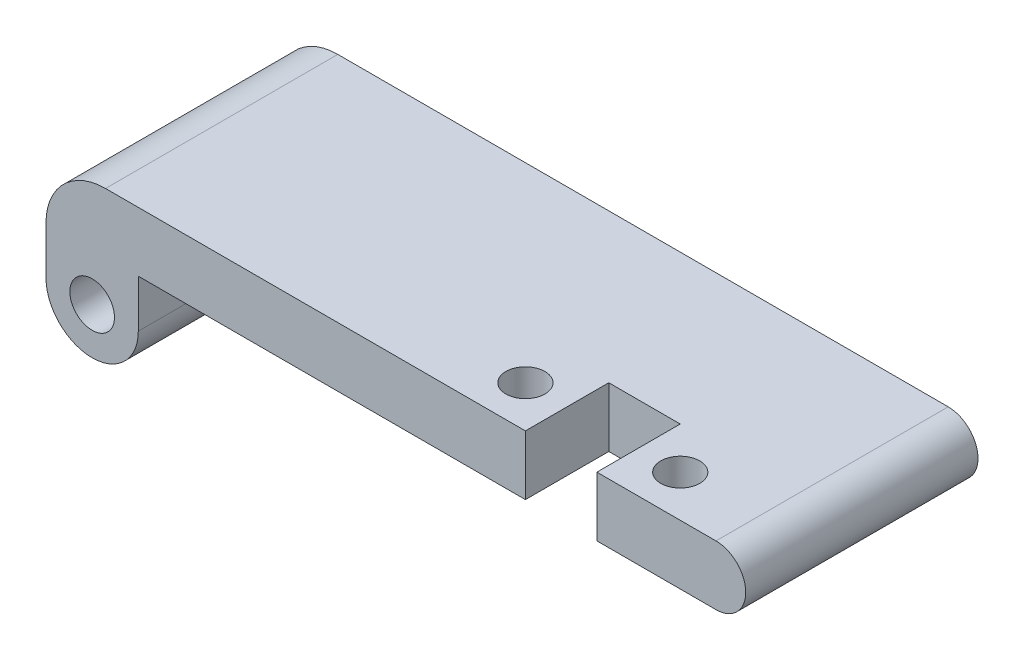
from build123d import *

# Parameters (mm, degrees)
SKETCH1_R                = 2.38125
BOSS_EXTRUDE1_DEPTH      = 38.1
FILLET1_R                = 6.35
SKETCH3_W                = 38.1
SKETCH3_H                = 6.35
BOSS_EXTRUDE2_DEPTH      = 12.7
SKETCH2_W                = 7.62
SKETCH2_H                = 8.89
CUT_EXTRUDE7_DEPTH       = 66.019560197
BOSS_EXTRUDE5_DEPTH      = 22.225
BOSS_EXTRUDE5_DEPTH_BACK = 9.525
SKETCH10_W               = 7.62
SKETCH10_H               = 8.89
CUT_EXTRUDE1_DEPTH       = 62.376176621
CUT_EXTRUDE1_DEPTH_BACK  = 62.376176621
SKETCH5_R                = 1.905
SKETCH6_W                = 8.89
SKETCH6_H                = 8.89
BOSS_EXTRUDE4_DEPTH      = 3.175
CUT_EXTRUDE2_DEPTH       = 71.485759779
CUT_EXTRUDE2_DEPTH_BACK  = 71.485759779
SKETCH7_R                = 2.0828
CUT_EXTRUDE8_DEPTH       = 13.335
SKETCH11_W               = 7.62
SKETCH11_H               = 8.89
CUT_EXTRUDE9_DEPTH       = 68.896996404
SKETCH12_W               = 8.89
SKETCH12_H               = 8.89
CUT_EXTRUDE10_DEPTH      = 3.175
CUT_EXTRUDE11_DEPTH      = 58.406346519


with BuildPart() as part:
    # Sketch1 → Boss-Extrude1 (new body)
    with BuildSketch(Plane.XY):
        with BuildLine():
            Line((-37.385625, -8.255), (-37.385625, -3.175))
            Line((-37.385625, -3.175), (-37.385625, 3.175))
            Line((-37.385625, 3.175), (37.385625, 3.175))
            Line((37.385625, 3.175), (37.385625, -3.175))
            Line((37.385625, -3.175), (-27.543125, -3.175))
            Line((-27.543125, -3.175), (-27.543125, -8.255))
            ThreePointArc((-27.543125, -8.255), (-32.464375, -13.17625), (-37.385625, -8.255))
        make_face()
        with Locations(Location((-32.464375, -8.255, 0), (0, 0, 180))):
            Circle(SKETCH1_R, mode=Mode.SUBTRACT)
    extrude(amount=BOSS_EXTRUDE1_DEPTH)

    # Fillet1
    fillet1_edges = [part.edges().sort_by_distance(p)[0] for p in [
        (-37.385625, 3.175, 19.05),
    ]]
    fillet(fillet1_edges, radius=FILLET1_R)

    # Sketch3 → Boss-Extrude2 (add)
    with BuildSketch(Plane(origin=(37.385625, 0, 0), x_dir=(0, 0, -1), z_dir=(1, 0, 0))):
        with Locations((-19.05, 0)):
            Rectangle(SKETCH3_W, SKETCH3_H)
    extrude(amount=BOSS_EXTRUDE2_DEPTH)

    # Sketch2 → Cut-Extrude7 (cut, through all)
    with BuildSketch(Plane(origin=(0, 3.175, 0), x_dir=(1, 0, 0), z_dir=(0, 1, 0))):
        with Locations((17.541875, -20.32)):
            Rectangle(SKETCH2_W, SKETCH2_H)
    extrude(amount=-CUT_EXTRUDE7_DEPTH, mode=Mode.SUBTRACT)

    # Sketch10 → Boss-Extrude5 (add, two sides: drawn at the far end of the back side and taken through both)
    with BuildSketch(Plane(origin=(0, 3.175, 0), x_dir=(1, 0, 0), z_dir=(0, 1, 0)).offset(-BOSS_EXTRUDE5_DEPTH_BACK)):
        with Locations((17.541875, -20.32)):
            Rectangle(SKETCH10_W, SKETCH10_H)
    extrude(amount=BOSS_EXTRUDE5_DEPTH + BOSS_EXTRUDE5_DEPTH_BACK)

    # Sketch5 → Cut-Extrude1 (cut, two sides: drawn at the far end of the back side and taken through both)
    with BuildSketch(Plane.XY.offset(24.765).offset(-CUT_EXTRUDE1_DEPTH_BACK)):
        with Locations((17.541875, 5.715)):
            Circle(SKETCH5_R)
        with Locations((17.541875, 23.1775)):
            Circle(SKETCH5_R)
    extrude(amount=CUT_EXTRUDE1_DEPTH + CUT_EXTRUDE1_DEPTH_BACK, mode=Mode.SUBTRACT)

    # Sketch6 → Boss-Extrude4 (add)
    with BuildSketch(Plane(origin=(0, -3.175, 0), x_dir=(1, 0, 0), z_dir=(0, 1, 0))):
        with Locations((9.286875, -20.32)):
            Rectangle(SKETCH6_W, SKETCH6_H)
        with Locations((25.796875, -20.32)):
            Rectangle(SKETCH6_W, SKETCH6_H)
    extrude(amount=-BOSS_EXTRUDE4_DEPTH)

    # Sketch7 → Cut-Extrude2 (cut, two sides: drawn at the far end of the back side and taken through both)
    with BuildSketch(Plane(origin=(0, -6.35, 0), x_dir=(-1, 0, 0), z_dir=(0, -1, 0)).offset(-CUT_EXTRUDE2_DEPTH_BACK)):
        with Locations(Location((-9.286875, -20.32, 0), (0, 0, 90))):
            Circle(SKETCH7_R)
        with Locations(Location((-25.796875, -20.32, 0), (0, 0, 90))):
            Circle(SKETCH7_R)
    extrude(amount=CUT_EXTRUDE2_DEPTH + CUT_EXTRUDE2_DEPTH_BACK, mode=Mode.SUBTRACT)

    # Sketch9 → Cut-Extrude8 (cut)
    with BuildSketch(Plane.XY.offset(38.1)):
        with BuildLine():
            Line((50.085625, 3.175), (50.085625, -3.175))
            Line((50.085625, -3.175), (-27.543125, -3.175))
            Line((-27.543125, -3.175), (-27.543125, -8.255))
            ThreePointArc((-27.543125, -8.255), (-32.464375, -13.17625), (-37.385625, -8.255))
            Line((-37.385625, -8.255), (-37.385625, -3.175))
            ThreePointArc((-37.385625, -3.175), (-35.525753061, 1.315128061), (-31.035625, 3.175))
            Line((-31.035625, 3.175), (50.085625, 3.175))
        make_face()
    extrude(amount=-CUT_EXTRUDE8_DEPTH, mode=Mode.SUBTRACT)

    # Sketch11 → Cut-Extrude9 (cut, through all)
    with BuildSketch(Plane(origin=(0, 25.4, 0), x_dir=(1, 0, 0), z_dir=(0, 1, 0))):
        with Locations((17.541875, -20.32)):
            Rectangle(SKETCH11_W, SKETCH11_H)
    extrude(amount=-CUT_EXTRUDE9_DEPTH, mode=Mode.SUBTRACT)

    # Sketch12 → Cut-Extrude10 (cut)
    with BuildSketch(Plane.XZ.offset(6.35)):
        with Locations((9.286875, 20.32)):
            Rectangle(SKETCH12_W, SKETCH12_H)
        with Locations((25.796875, 20.32)):
            Rectangle(SKETCH12_W, SKETCH12_H)
    extrude(amount=-CUT_EXTRUDE10_DEPTH, mode=Mode.SUBTRACT)

    # Sketch13 → Cut-Extrude11 (cut, through all)
    with BuildSketch(Plane.XY.offset(24.765)):
        with BuildLine():
            Line((34.051875, 3.175), (50.085625, 3.175))
            Line((50.085625, 3.175), (50.085625, -3.175))
            Line((50.085625, -3.175), (34.051875, -3.175))
            ThreePointArc((34.051875, -3.175), (37.226875, 0), (34.051875, 3.175))
        make_face()
    extrude(amount=-CUT_EXTRUDE11_DEPTH, mode=Mode.SUBTRACT)


solid = part.part
